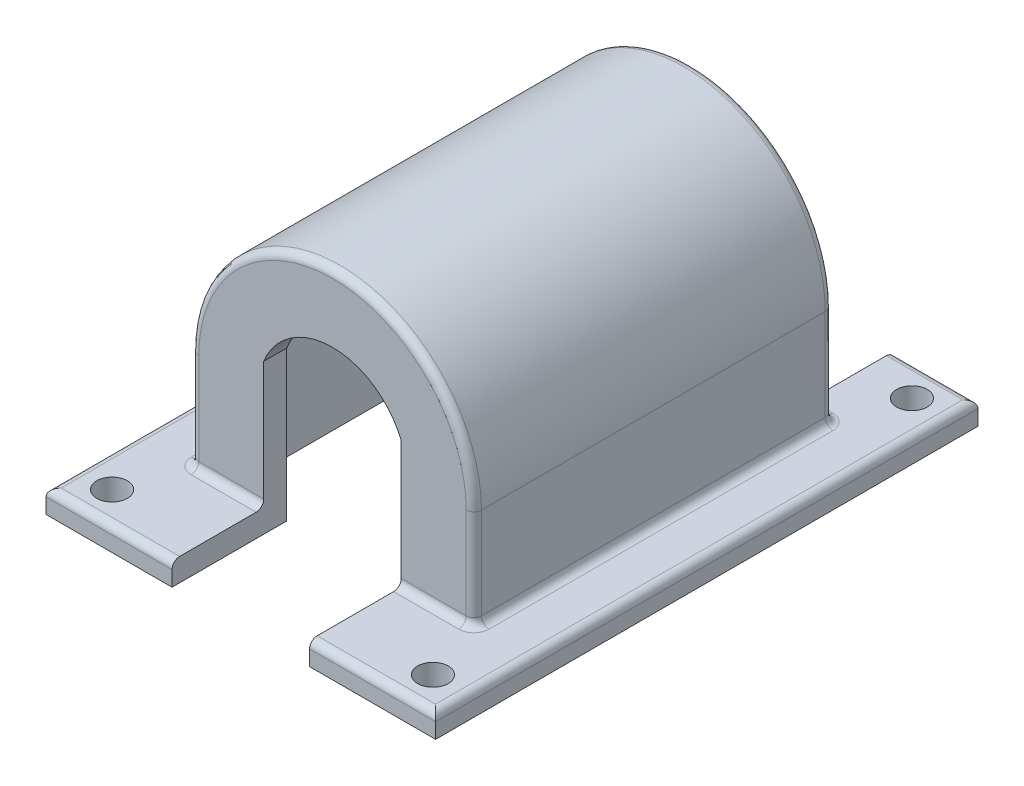
from build123d import *

# Parameters (mm, degrees)
BOSS_EXTRU_1_DEPTH      = 3
BOSS_EXTRU_2_DEPTH      = 44
BOSS_EXTRU_4_START      = -3
BOSS_EXTRU_4_DEPTH      = 3
BOSS_EXTRU_6_DEPTH      = 16
ESQUISSE10_W            = 71
ESQUISSE10_H            = 3
BOSS_EXTRU_10_DEPTH     = 7
ESQUISSE12_R            = 2
ENL_V_MAT_EXTRU_1_DEPTH = 73.94861205
ESQUISSE13_W            = 12
ESQUISSE13_H            = 3
BOSS_EXTRU_11_DEPTH     = 9.5
ESQUISSE14_W            = 12
ESQUISSE14_H            = 3
BOSS_EXTRU_12_DEPTH     = 9.5
ESQUISSE15_W            = 12
ESQUISSE15_H            = 3
BOSS_EXTRU_13_DEPTH     = 4
ESQUISSE16_W            = 12
ESQUISSE16_H            = 3
BOSS_EXTRU_14_DEPTH     = 4
CONG_7_R                = 1


with BuildPart() as part:
    # Esquisse1 → Boss.-Extru.1 (new body)
    with BuildSketch(Plane.XY):
        with BuildLine():
            Line((-18.5, 0), (-14.5, 0))
            ThreePointArc((-14.5, 0), (0, 14.5), (14.5, 0))
            Line((14.5, 0), (18.5, 0))
            ThreePointArc((18.5, 0), (0, 18.5), (-18.5, 0))
        make_face()
    extrude(amount=BOSS_EXTRU_1_DEPTH)

    # Esquisse3 → Boss.-Extru.2 (add)
    with BuildSketch(Plane.XY.offset(3)):
        with BuildLine():
            Line((-18.5, 0), (-16.25, 0))
            ThreePointArc((-16.25, 0), (0, 16.25), (16.25, 0))
            Line((16.25, 0), (18.5, 0))
            ThreePointArc((18.5, 0), (0, 18.5), (-18.5, 0))
        make_face()
    extrude(amount=BOSS_EXTRU_2_DEPTH)

    # Esquisse4 → Boss.-Extru.4 (add)
    with BuildSketch(Plane.XY.offset(47).offset(BOSS_EXTRU_4_START)):
        with BuildLine():
            Line((9, 0), (18.5, 0))
            ThreePointArc((18.5, 0), (0, 18.5), (-18.5, 0))
            Line((-18.5, 0), (-9, 0))
            Line((-9, 0), (-9, 3.618010503))
            ThreePointArc((-9, 3.618010503), (0, 9.7), (9, 3.618010503))
            Line((9, 3.618010503), (9, 0))
        make_face()
    extrude(amount=BOSS_EXTRU_4_DEPTH)

    # Esquisse6 → Boss.-Extru.6 (add)
    with BuildSketch(Plane.XZ):
        Polygon((14.5, 3), (16.25, 3), (16.25, 44), (9, 44), (9, 47), (18.5, 47), (18.5, 0), (14.5, 0), align=None)
        Polygon((-14.5, 3), (-14.5, 0), (-18.5, 0), (-18.5, 47), (-9, 47), (-9, 44), (-16.25, 44), (-16.25, 3), align=None)
    extrude(amount=BOSS_EXTRU_6_DEPTH)

    # Esquisse10 → Boss.-Extru.10 (add)
    with BuildSketch(Plane(origin=(18.5, 0, 0), x_dir=(0, 0, -1), z_dir=(1, 0, 0))):
        with Locations((-23.5, -14.5)):
            Rectangle(ESQUISSE10_W, ESQUISSE10_H)
    boss_extru_10 = extrude(amount=BOSS_EXTRU_10_DEPTH)

    # Symétrie4: Boss.-Extru.10 across plane
    add(boss_extru_10.mirror(Plane(origin=(0, 0, 0), x_dir=(0, 0, 1), z_dir=(1, 0, 0))))

    # Esquisse12 → Enlèv. mat.-Extru.1 (cut, through all)
    with BuildSketch(Plane.XZ.offset(16)):
        with Locations(Location((21, 54.85, 0), (0, 0, 270))):
            Circle(ESQUISSE12_R)
        with Locations(Location((21, -7.85, 0), (0, 0, 270))):
            Circle(ESQUISSE12_R)
        with Locations(Location((-21, -7.85, 0), (0, 0, 270))):
            Circle(ESQUISSE12_R)
        with Locations(Location((-21, 54.85, 0), (0, 0, 270))):
            Circle(ESQUISSE12_R)
    extrude(amount=-ENL_V_MAT_EXTRU_1_DEPTH, mode=Mode.SUBTRACT)

    # Esquisse13 → Boss.-Extru.11 (add)
    with BuildSketch(Plane(origin=(-18.5, 0, 0), x_dir=(0, 0, -1), z_dir=(1, 0, 0))):
        with Locations((-53, -14.5)):
            Rectangle(ESQUISSE13_W, ESQUISSE13_H)
    extrude(amount=BOSS_EXTRU_11_DEPTH)

    # Esquisse14 → Boss.-Extru.12 (add)
    with BuildSketch(Plane.ZY.offset(-18.5)):
        with Locations((53, -14.5)):
            Rectangle(ESQUISSE14_W, ESQUISSE14_H)
    extrude(amount=BOSS_EXTRU_12_DEPTH)

    # Esquisse15 → Boss.-Extru.13 (add)
    with BuildSketch(Plane.ZY.offset(-18.5)):
        with Locations((-6, -14.5)):
            Rectangle(ESQUISSE15_W, ESQUISSE15_H)
    extrude(amount=BOSS_EXTRU_13_DEPTH)

    # Esquisse16 → Boss.-Extru.14 (add)
    with BuildSketch(Plane(origin=(-18.5, 0, 0), x_dir=(0, 0, -1), z_dir=(1, 0, 0))):
        with Locations((6, -14.5)):
            Rectangle(ESQUISSE16_W, ESQUISSE16_H)
    extrude(amount=BOSS_EXTRU_14_DEPTH)

    # Congé7
    cong_7_edges = [part.edges().sort_by_distance(p)[0] for p in [
        (-18.5, -6.5, 0),
        (-18.5, -6.5, 47),
        (-18.5, -13, 23.5),
        (-20, -13, -12),
        (-25.5, -13, 23.5),
        (-17.25, -13, 59),
        (-13.75, -13, 47),
        (13.75, -13, 47),
        (0, 18.5, 47),
        (16.5, -13, 0),
        (-16.5, -13, 0),
        (0, 18.5, 0),
        (18.5, -6.5, 47),
        (18.5, -6.5, 0),
        (18.5, -13, 23.5),
        (20, -13, -12),
        (17.25, -13, 59),
        (25.5, -13, 23.5),
    ]]
    fillet(cong_7_edges, radius=CONG_7_R)


solid = part.part
